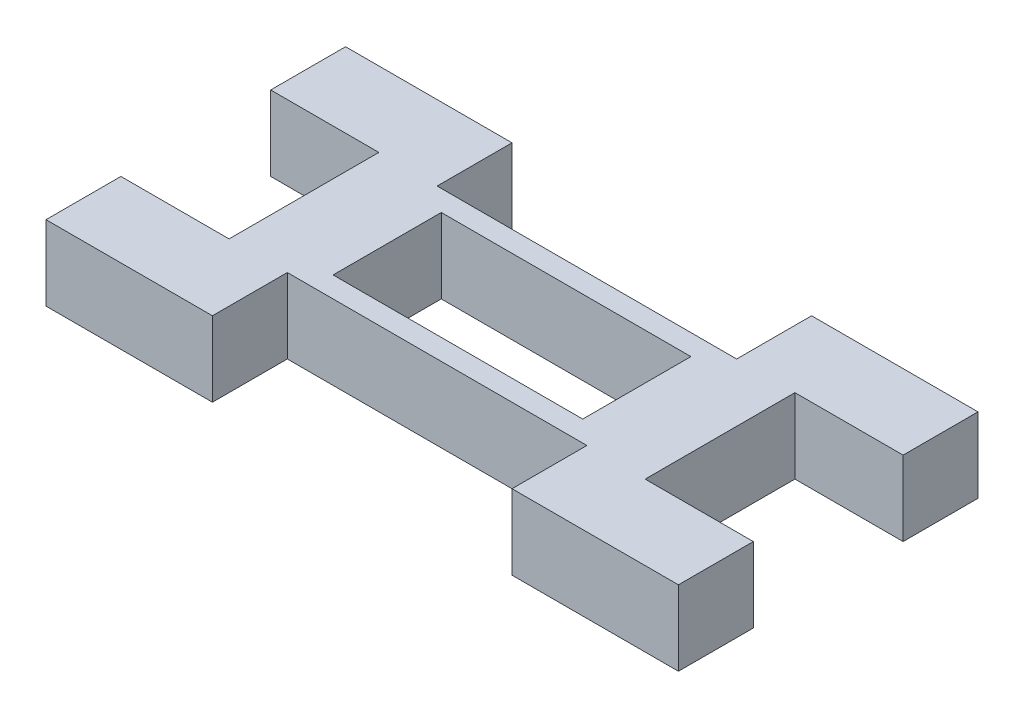
from build123d import *

# Parameters (mm, degrees)
SKETCH1_W               = 55
SKETCH1_H               = 9
BOSS_EXTRUDE1_DEPTH     = 4.5
SKETCH2_W               = 10
SKETCH2_H               = 4.5
BOSS_EXTRUDE2_DEPTH     = 4.5
CUT_EXTRUDE1_DEPTH      = 30.283100929
CUT_EXTRUDE1_DEPTH_BACK = 30.283100929
SKETCH3_W               = 30
SKETCH3_H               = 9
SKETCH3_W_2             = 15
SKETCH3_H_2             = 6.5


with BuildPart() as part:
    # Sketch1 → Boss-Extrude1 (new body)
    with BuildSketch(Plane(origin=(0, 0, 0), x_dir=(1, 0, 0), z_dir=(0, 1, 0))):
        Rectangle(SKETCH1_W, SKETCH1_H)
    extrude(amount=BOSS_EXTRUDE1_DEPTH)

    # Sketch2 → Boss-Extrude2 (add, through all)
    with BuildSketch(Plane(origin=(0, 4.5, 0), x_dir=(1, 0, 0), z_dir=(0, 1, 0))):
        with Locations((-14, -6.75)):
            Rectangle(SKETCH2_W, SKETCH2_H)
        with Locations((14, -6.75)):
            Rectangle(SKETCH2_W, SKETCH2_H)
        with Locations((14, 6.75)):
            Rectangle(SKETCH2_W, SKETCH2_H)
        with Locations((-14, 6.75)):
            Rectangle(SKETCH2_W, SKETCH2_H)
    extrude(amount=-BOSS_EXTRUDE2_DEPTH)

    # Sketch3 → Cut-Extrude1 (cut, two sides: drawn at the far end of the back side and taken through both)
    with BuildSketch(Plane(origin=(0, 4.5, 0), x_dir=(1, 0, 0), z_dir=(0, 1, 0)).offset(-CUT_EXTRUDE1_DEPTH_BACK)):
        with Locations((-27.5, 0)):
            Rectangle(SKETCH3_W, SKETCH3_H)
        with Locations((27.5, 0)):
            Rectangle(SKETCH3_W, SKETCH3_H)
        Rectangle(SKETCH3_W_2, SKETCH3_H_2)
    extrude(amount=CUT_EXTRUDE1_DEPTH + CUT_EXTRUDE1_DEPTH_BACK, mode=Mode.SUBTRACT)


solid = part.part
